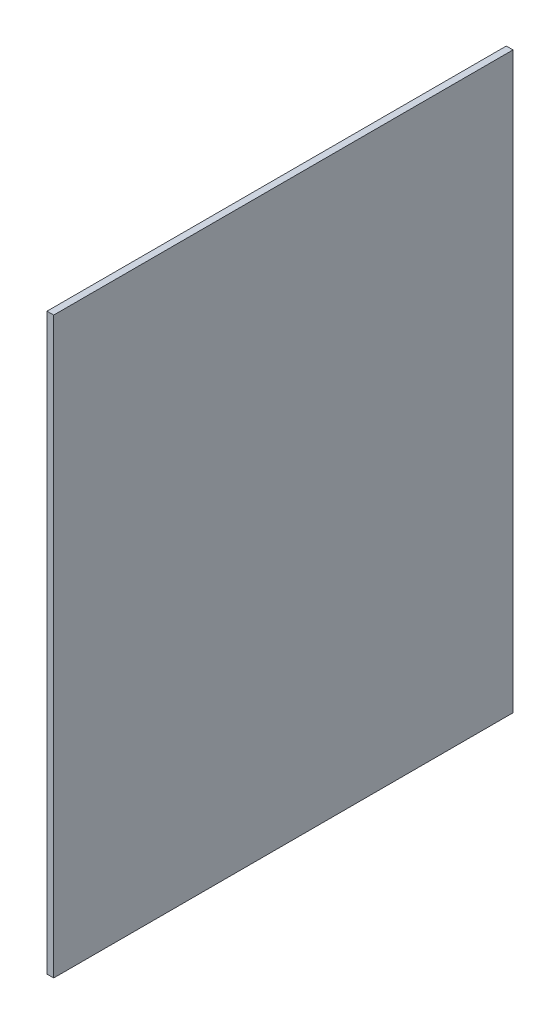
from build123d import *

# Parameters (mm, degrees)
SKETCH1_W           = 254
SKETCH1_H           = 203.2
BOSS_EXTRUDE1_DEPTH = 2.9718


with BuildPart() as part:
    # Sketch1 → Boss-Extrude1 (new body)
    with BuildSketch(Plane.YZ):
        with Locations((121.454580897, 101.6)):
            Rectangle(SKETCH1_W, SKETCH1_H)
    extrude(amount=BOSS_EXTRUDE1_DEPTH)


solid = part.part
